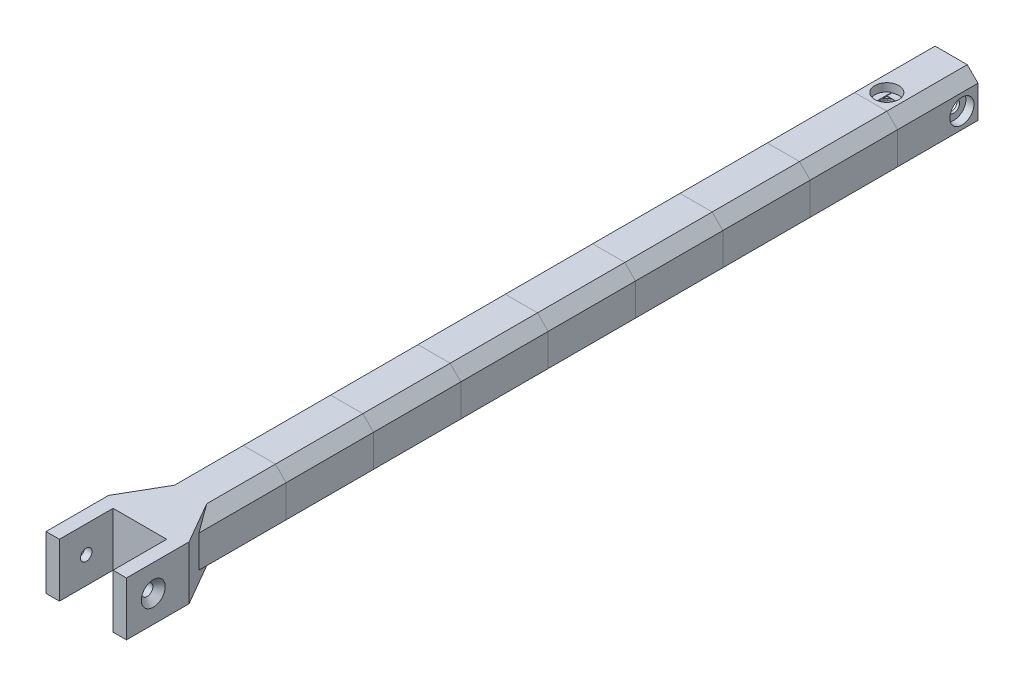
from build123d import *
from build123d.topology import SkipClean

# Parameters (mm, degrees)
SKETCH1_W             = 20
SKETCH1_H             = 20
BOSS_EXTRUDE1_DEPTH   = 302.5
BOSS_EXTRUDE2_DEPTH   = 20
SKETCH3_R             = 2.15
CUT_EXTRUDE1_DEPTH    = 325.046678736
SKETCH4_W             = 4
SKETCH4_H             = 30
CUT_EXTRUDE2_DEPTH    = 324.467540875
CHAMFER1_SIZE         = 2.3
SKETCH5_W             = 15
SKETCH5_H             = 8
CUT_EXTRUDE3_DEPTH    = 324.337671792
SKETCH6_R             = 3.2
CUT_EXTRUDE4_DEPTH    = 324.071586494
SKETCH7_R             = 3.2
CUT_EXTRUDE5_DEPTH    = 324.337671792
SKETCH10_W            = 20
SKETCH10_H            = 32.5625
CUT_EXTRUDE7_DEPTH    = 324.467540875
SKETCH11_W            = 20
SKETCH11_H            = 32.5625
BOSS_EXTRUDE3_DEPTH   = 20
BOSS_EXTRUDE3_2_DEPTH = 20
BOSS_EXTRUDE3_3_DEPTH = 20
BOSS_EXTRUDE3_4_DEPTH = 20
CHAMFER3_SIZE         = 4
CUT_EXTRUDE8_DEPTH    = 227.9375
SKETCH13_W            = 15
SKETCH13_H            = 4
CUT_EXTRUDE9_DEPTH    = 324.337671792
SKETCH15_W            = 12
SKETCH15_H            = 16
CUT_EXTRUDE10_DEPTH   = 30
BOSS_EXTRUDE4_DEPTH   = 30
SKETCH16_W            = 12
SKETCH16_H            = 15
BOSS_EXTRUDE5_DEPTH   = 4
SKETCH17_R            = 2.15
CUT_EXTRUDE11_DEPTH   = 324.071586494
SKETCH18_R            = 2.15
CUT_EXTRUDE12_DEPTH   = 324.622078975
SKETCH19_R            = 4.5
CUT_EXTRUDE13_DEPTH   = 3
SKETCH20_R            = 4.5
CUT_EXTRUDE14_DEPTH   = 3
CUT_EXTRUDE15_DEPTH   = 0.2
SKETCH22_W            = 4.3
SKETCH22_H            = 4.3
CUT_EXTRUDE16_DEPTH   = 0.2


with BuildPart() as part:
    # Sketch1 → Boss-Extrude1 (new body)
    with BuildSketch(Plane.XY):
        Rectangle(SKETCH1_W, SKETCH1_H)
    extrude(amount=BOSS_EXTRUDE1_DEPTH)

    # Sketch2 → Boss-Extrude2 (add)
    with BuildSketch(Plane(origin=(0, 10, 0), x_dir=(1, 0, 0), z_dir=(0, 1, 0))):
        Polygon((10, -302.5), (10, -322.5), (15, -322.5), (15, -299.160254038), (10, -290.5), align=None)
        Polygon((-10, -290.5), (-10, -302.5), (-10, -322.5), (-15, -322.5), (-15, -299.160254038), align=None)
    extrude(amount=-BOSS_EXTRUDE2_DEPTH)

    # Sketch3 → Cut-Extrude1 (cut, through all)
    with BuildSketch(Plane(origin=(15, 0, 0), x_dir=(0, 0, -1), z_dir=(1, 0, 0))):
        with Locations((-312.5, 0)):
            Circle(SKETCH3_R)
    extrude(amount=-CUT_EXTRUDE1_DEPTH, mode=Mode.SUBTRACT)

    # Sketch4 → Cut-Extrude2 (cut, through all)
    with BuildSketch(Plane(origin=(0, 10, 0), x_dir=(1, 0, 0), z_dir=(0, 1, 0))):
        with Locations((-8, -15)):
            Rectangle(SKETCH4_W, SKETCH4_H)
        with Locations((8, -15)):
            Rectangle(SKETCH4_W, SKETCH4_H)
    extrude(amount=-CUT_EXTRUDE2_DEPTH, mode=Mode.SUBTRACT)

    # Chamfer1
    chamfer1_edges = [part.edges().sort_by_distance(p)[0] for p in [
        (-15, 0, 314.65),
        (15, 0, 314.65),
    ]]
    chamfer(chamfer1_edges, length=CHAMFER1_SIZE)

    # Sketch5 → Cut-Extrude3 (cut, through all)
    with BuildSketch(Plane(origin=(6, 0, 0), x_dir=(0, 0, -1), z_dir=(1, 0, 0))):
        with Locations((-7.5, 6)):
            Rectangle(SKETCH5_W, SKETCH5_H)
    extrude(amount=-CUT_EXTRUDE3_DEPTH, mode=Mode.SUBTRACT)

    # Sketch6 → Cut-Extrude4 (cut, through all)
    with BuildSketch(Plane(origin=(0, 2, 0), x_dir=(1, 0, 0), z_dir=(0, 1, 0))):
        with Locations(Location((0, -6, 0), (0, 0, 270))):
            Circle(SKETCH6_R)
    extrude(amount=-CUT_EXTRUDE4_DEPTH, mode=Mode.SUBTRACT)

    # Sketch7 → Cut-Extrude5 (cut, through all)
    with BuildSketch(Plane(origin=(6, 0, 0), x_dir=(0, 0, -1), z_dir=(1, 0, 0))):
        with Locations((-24, 0)):
            Circle(SKETCH7_R)
    extrude(amount=-CUT_EXTRUDE5_DEPTH, mode=Mode.SUBTRACT)

    # Sketch10 → Cut-Extrude7 (cut, through all)
    with BuildSketch(Plane(origin=(0, 10, 0), x_dir=(1, 0, 0), z_dir=(0, 1, 0))):
        with Locations((0, -46.28125)):
            Rectangle(SKETCH10_W, SKETCH10_H)
        with Locations((0, -111.40625)):
            Rectangle(SKETCH10_W, SKETCH10_H)
        with Locations((0, -176.53125)):
            Rectangle(SKETCH10_W, SKETCH10_H)
        with Locations((0, -241.65625)):
            Rectangle(SKETCH10_W, SKETCH10_H)
    extrude(amount=-CUT_EXTRUDE7_DEPTH, mode=Mode.SUBTRACT)


with BuildPart() as cut_extrude7_piece_1:
    # of the separate pieces the step leaves, piece 1, a body of its own (cut_extrude7_pieces)
    add(part.part.solids().sort_by_distance((15, 0, 308.05))[0])

    # Chamfer3
    chamfer3_edges = [cut_extrude7_piece_1.edges().sort_by_distance(p)[0] for p in [
        (10, 10, 274.21875),
        (-10, 10, 274.21875),
        (-10, -10, 274.21875),
        (10, -10, 274.21875),
    ]]
    chamfer(chamfer3_edges, length=CHAMFER3_SIZE)


with BuildPart() as cut_extrude7_piece_2:
    # of the separate pieces the step leaves, piece 2, a body of its own (cut_extrude7_pieces)
    add(part.part.solids().sort_by_distance((10, 10, 192.8125))[0])


with BuildPart() as cut_extrude7_piece_3:
    # of the separate pieces the step leaves, piece 3, a body of its own (cut_extrude7_pieces)
    add(part.part.solids().sort_by_distance((10, 10, 62.5625))[0])


with BuildPart() as cut_extrude7_piece_4:
    # of the separate pieces the step leaves, piece 4, a body of its own (cut_extrude7_pieces)
    add(part.part.solids().sort_by_distance((-10, 10, 127.6875))[0])


with BuildPart() as cut_extrude7_piece_5:
    # of the separate pieces the step leaves, piece 5, a body of its own (cut_extrude7_pieces)
    add(part.part.solids().sort_by_distance((6, 10, 15))[0])

    # Sketch13 → Cut-Extrude9 (cut, through all)
    with BuildSketch(Plane(origin=(6, 0, 0), x_dir=(0, 0, -1), z_dir=(1, 0, 0))):
        with Locations((-22.5, 8)):
            Rectangle(SKETCH13_W, SKETCH13_H)
    extrude(amount=-CUT_EXTRUDE9_DEPTH, mode=Mode.SUBTRACT)

    # Sketch15 → Cut-Extrude10 (cut)
    with BuildSketch(Plane(origin=(0, 0, 0), x_dir=(-1, 0, 0), z_dir=(0, 0, -1))):
        with Locations((0, -2)):
            Rectangle(SKETCH15_W, SKETCH15_H)
    extrude(amount=-CUT_EXTRUDE10_DEPTH, mode=Mode.SUBTRACT)


with BuildPart() as body_6:
    # Sketch11 → Boss-Extrude3 (new body)
    with BuildSketch(Plane(origin=(0, 10, 0), x_dir=(1, 0, 0), z_dir=(0, 1, 0))):
        with Locations((0, -46.28125)):
            Rectangle(SKETCH11_W, SKETCH11_H)
    extrude(amount=-BOSS_EXTRUDE3_DEPTH)


with BuildPart() as body_7:
    # Sketch11 → Boss-Extrude3 2 (new body)
    with BuildSketch(Plane(origin=(0, 10, 0), x_dir=(1, 0, 0), z_dir=(0, 1, 0))):
        with Locations((0, -111.40625)):
            Rectangle(SKETCH11_W, SKETCH11_H)
    extrude(amount=-BOSS_EXTRUDE3_2_DEPTH)


with BuildPart() as body_8:
    # Sketch11 → Boss-Extrude3 3 (new body)
    with BuildSketch(Plane(origin=(0, 10, 0), x_dir=(1, 0, 0), z_dir=(0, 1, 0))):
        with Locations((0, -176.53125)):
            Rectangle(SKETCH11_W, SKETCH11_H)
    extrude(amount=-BOSS_EXTRUDE3_3_DEPTH)


with BuildPart() as body_9:
    # Sketch11 → Boss-Extrude3 4 (new body)
    with BuildSketch(Plane(origin=(0, 10, 0), x_dir=(1, 0, 0), z_dir=(0, 1, 0))):
        with Locations((0, -241.65625)):
            Rectangle(SKETCH11_W, SKETCH11_H)
    extrude(amount=-BOSS_EXTRUDE3_4_DEPTH)


with BuildPart() as cut_extrude8_tool:
    # Sketch12 → Cut-Extrude8 (new body)
    with BuildSketch(Plane(origin=(0, 0, 30), x_dir=(-1, 0, 0), z_dir=(0, 0, -1))):
        Polygon((-10, 10), (-6, 10), (-10, 6), align=None)
        Polygon((-10, -10), (-10, -6), (-6, -10), align=None)
        Polygon((6, 10), (10, 10), (10, 6), align=None)
        Polygon((10, -10), (10, -6), (6, -10), align=None)
    extrude(amount=-CUT_EXTRUDE8_DEPTH)


with BuildPart() as cut_extrude7_piece_2_1:
    add(cut_extrude7_piece_2.part)

    # Cut-Extrude8: cut by cut_extrude8_tool
    add(cut_extrude8_tool.part, mode=Mode.SUBTRACT)


with BuildPart() as cut_extrude7_piece_3_1:
    add(cut_extrude7_piece_3.part)

    # Cut-Extrude8: cut by cut_extrude8_tool
    add(cut_extrude8_tool.part, mode=Mode.SUBTRACT)


with BuildPart() as cut_extrude7_piece_4_1:
    add(cut_extrude7_piece_4.part)

    # Cut-Extrude8: cut by cut_extrude8_tool
    add(cut_extrude8_tool.part, mode=Mode.SUBTRACT)


with BuildPart() as body_6_1:
    add(body_6.part)

    # Cut-Extrude8: cut by cut_extrude8_tool
    add(cut_extrude8_tool.part, mode=Mode.SUBTRACT)

    # Sketch16 → Boss-Extrude5 (add)
    with BuildSketch(Plane.XZ.offset(-6)):
        with Locations((0, 22.5)):
            Rectangle(SKETCH16_W, SKETCH16_H)
    extrude(amount=BOSS_EXTRUDE5_DEPTH)


with BuildPart() as body_7_1:
    add(body_7.part)

    # Cut-Extrude8: cut by cut_extrude8_tool
    add(cut_extrude8_tool.part, mode=Mode.SUBTRACT)


with BuildPart() as body_8_1:
    add(body_8.part)

    # Cut-Extrude8: cut by cut_extrude8_tool
    add(cut_extrude8_tool.part, mode=Mode.SUBTRACT)


with BuildPart() as body_9_1:
    add(body_9.part)

    # Cut-Extrude8: cut by cut_extrude8_tool
    add(cut_extrude8_tool.part, mode=Mode.SUBTRACT)


with BuildPart() as body_9_2:
    # Sketch14 → Boss-Extrude4 (new body)
    with BuildSketch(Plane(origin=(0, 0, 30), x_dir=(-1, 0, 0), z_dir=(0, 0, -1))):
        Polygon((-6, -10), (-6, 6), (6, 6), (6, -10), (10, -6), (10, 6), (6, 10), (-6, 10), (-10, 6), (-10, -6), align=None)
    extrude(amount=BOSS_EXTRUDE4_DEPTH)


with BuildPart() as cut_extrude11_tool:
    # Sketch17 → Cut-Extrude11 (new, through all)
    with BuildSketch(Plane.XZ.offset(-2)):
        with Locations(Location((0, 24, 0), (0, 0, 270))):
            Circle(SKETCH17_R)
    extrude(amount=-CUT_EXTRUDE11_DEPTH)


with BuildPart() as body_6_2:
    add(body_6_1.part)

    # Cut-Extrude11: cut by cut_extrude11_tool
    add(cut_extrude11_tool.part, mode=Mode.SUBTRACT)


with BuildPart() as body_9_2_1:
    add(body_9_2.part)

    # Cut-Extrude11: cut by cut_extrude11_tool
    add(cut_extrude11_tool.part, mode=Mode.SUBTRACT)

    # Sketch18 → Cut-Extrude12 (cut, through all)
    with BuildSketch(Plane(origin=(10, 0, 0), x_dir=(0, 0, -1), z_dir=(1, 0, 0))):
        with Locations(Location((-6, 0, 0), (0, 0, 90))):
            Circle(SKETCH18_R)
    extrude(amount=-CUT_EXTRUDE12_DEPTH, mode=Mode.SUBTRACT)

    # Sketch19 → Cut-Extrude13 (cut)
    with BuildSketch(Plane(origin=(10, 0, 0), x_dir=(0, 0, -1), z_dir=(1, 0, 0))):
        with Locations((-6, 0)):
            Circle(SKETCH19_R)
    extrude(amount=-CUT_EXTRUDE13_DEPTH, mode=Mode.SUBTRACT)

    # Sketch20 → Cut-Extrude14 (cut)
    with BuildSketch(Plane(origin=(0, 10, 0), x_dir=(1, 0, 0), z_dir=(0, 1, 0))):
        with Locations(Location((0, -24, 0), (0, 0, 270))):
            Circle(SKETCH20_R)
    extrude(amount=-CUT_EXTRUDE14_DEPTH, mode=Mode.SUBTRACT)

    # Sketch21 → Cut-Extrude15 (cut)
    with SkipClean():  # the faces are left unmerged after this step: merging them gives an invalid solid
        with BuildSketch(Plane(origin=(0, 7, 0), x_dir=(1, 0, 0), z_dir=(0, 1, 0))):
            with BuildLine():
                Line((-2.15, -27.95316329), (-2.15, -20.04683671))
                ThreePointArc((-2.15, -20.04683671), (0, -19.5), (2.15, -20.04683671))
                Line((2.15, -20.04683671), (2.15, -27.95316329))
                ThreePointArc((2.15, -27.95316329), (0, -28.5), (-2.15, -27.95316329))
            make_face()
        extrude(amount=-CUT_EXTRUDE15_DEPTH, mode=Mode.SUBTRACT)

    # Sketch22 → Cut-Extrude16 (cut)
    with SkipClean():  # the faces are left unmerged after this step: merging them gives an invalid solid
        with BuildSketch(Plane(origin=(0, 6.8, 0), x_dir=(1, 0, 0), z_dir=(0, 1, 0))):
            with Locations((0, -24)):
                Rectangle(SKETCH22_W, SKETCH22_H)
        extrude(amount=-CUT_EXTRUDE16_DEPTH, mode=Mode.SUBTRACT)


solid = Compound([cut_extrude7_piece_1.part, cut_extrude7_piece_2_1.part, cut_extrude7_piece_3_1.part, cut_extrude7_piece_4_1.part, body_7_1.part, body_8_1.part, body_9_1.part, body_6_2.part, body_9_2_1.part])
